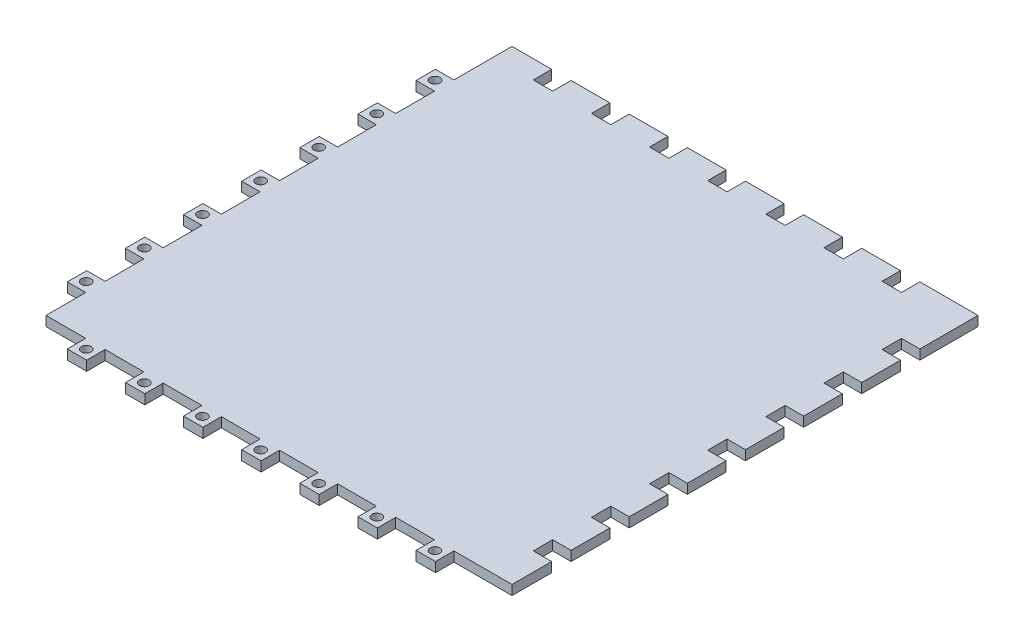
from build123d import *

# Parameters (mm, degrees)
SKETCH_1_R      = 0.5
EXTRUDE_2_DEPTH = 1


with BuildPart() as part:
    # Эскиз1 → Бобышка-Вытянуть2 (new body)
    with BuildSketch(Plane(origin=(0, 0, 0), x_dir=(1, 0, 0), z_dir=(0, 1, 0))):
        Polygon((25, -23.1), (25, -19), (23.1, -19), (23.1, -17), (25, -17), (25, -13), (23.1, -13), (23.1, -11), (25, -11), (25, -7), (23.1, -7), (23.1, -5), (25, -5), (25, -1), (23.1, -1), (23.1, 1), (25, 1), (25, 5), (23.1, 5), (23.1, 7), (25, 7), (25, 11), (23.1, 11), (23.1, 13), (25, 13), (25, 17), (23.1, 17), (23.1, 19), (25, 19), (25, 25), (19, 25), (19, 23.1), (17, 23.1), (17, 25), (13, 25), (13, 23.1), (11, 23.1), (11, 25), (7, 25), (7, 23.1), (5, 23.1), (5, 25), (1, 25), (1, 23.1), (-1, 23.1), (-1, 25), (-5, 25), (-5, 23.1), (-7, 23.1), (-7, 25), (-11, 25), (-11, 23.1), (-13, 23.1), (-13, 25), (-17, 25), (-17, 23.1), (-19, 23.1), (-19, 25), (-23.1, 25), (-23.1, 19), (-25, 19), (-25, 17), (-23.1, 17), (-23.1, 13), (-25, 13), (-25, 11), (-23.1, 11), (-23.1, 7), (-25, 7), (-25, 5), (-23.1, 5), (-23.1, 1), (-25, 1), (-25, -1), (-23.1, -1), (-23.1, -5), (-25, -5), (-25, -7), (-23.1, -7), (-23.1, -11), (-25, -11), (-25, -13), (-23.1, -13), (-23.1, -17), (-25, -17), (-25, -19), (-23.1, -19), (-23.1, -23.1), (-19, -23.1), (-19, -25), (-17, -25), (-17, -23.1), (-13, -23.1), (-13, -25), (-11, -25), (-11, -23.1), (-7, -23.1), (-7, -25), (-5, -25), (-5, -23.1), (-1, -23.1), (-1, -25), (1, -25), (1, -23.1), (5, -23.1), (5, -25), (7, -25), (7, -23.1), (11, -23.1), (11, -25), (13, -25), (13, -23.1), (17, -23.1), (17, -25), (19, -25), (19, -23.1), align=None)
        with Locations(Location((18, -24.05, 0), (0, 0, 270))):
            Circle(SKETCH_1_R, mode=Mode.SUBTRACT)
        with Locations(Location((12, -24.05, 0), (0, 0, 270))):
            Circle(SKETCH_1_R, mode=Mode.SUBTRACT)
        with Locations(Location((6, -24.05, 0), (0, 0, 270))):
            Circle(SKETCH_1_R, mode=Mode.SUBTRACT)
        with Locations(Location((0, -24.05, 0), (0, 0, 270))):
            Circle(SKETCH_1_R, mode=Mode.SUBTRACT)
        with Locations(Location((-6, -24.05, 0), (0, 0, 270))):
            Circle(SKETCH_1_R, mode=Mode.SUBTRACT)
        with Locations(Location((-12, -24.05, 0), (0, 0, 270))):
            Circle(SKETCH_1_R, mode=Mode.SUBTRACT)
        with Locations(Location((-18, -24.05, 0), (0, 0, 270))):
            Circle(SKETCH_1_R, mode=Mode.SUBTRACT)
        with Locations(Location((-24.05, -18, 0), (0, 0, 270))):
            Circle(SKETCH_1_R, mode=Mode.SUBTRACT)
        with Locations(Location((-24.05, -12, 0), (0, 0, 270))):
            Circle(SKETCH_1_R, mode=Mode.SUBTRACT)
        with Locations(Location((-24.05, -6, 0), (0, 0, 270))):
            Circle(SKETCH_1_R, mode=Mode.SUBTRACT)
        with Locations(Location((-24.05, 0, 0), (0, 0, 270))):
            Circle(SKETCH_1_R, mode=Mode.SUBTRACT)
        with Locations(Location((-24.05, 6, 0), (0, 0, 270))):
            Circle(SKETCH_1_R, mode=Mode.SUBTRACT)
        with Locations(Location((-24.05, 12, 0), (0, 0, 270))):
            Circle(SKETCH_1_R, mode=Mode.SUBTRACT)
        with Locations(Location((-24.05, 18, 0), (0, 0, 270))):
            Circle(SKETCH_1_R, mode=Mode.SUBTRACT)
    extrude(amount=EXTRUDE_2_DEPTH)


solid = part.part
